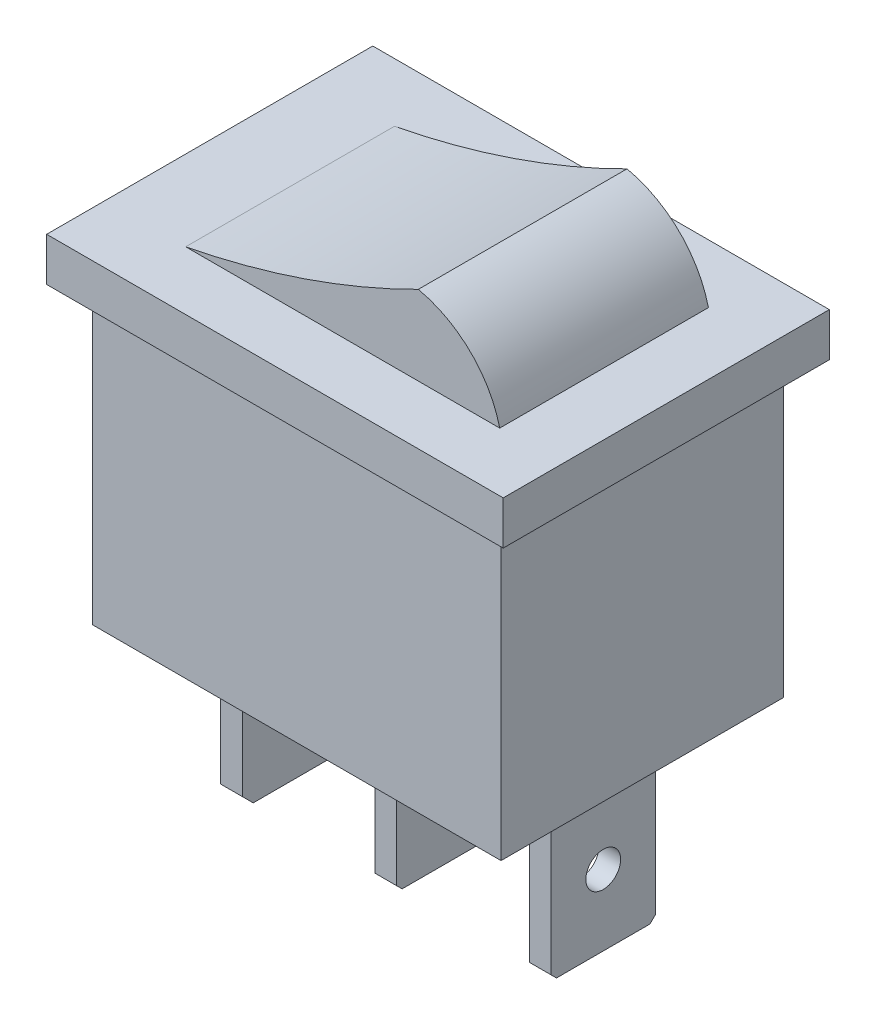
from build123d import *

# Parameters (mm, degrees)
BOSS_EXTRUDE1_DEPTH            = 9.6
SKETCH2_W                      = 21
SKETCH2_H                      = 15
BOSS_EXTRUDE2_DEPTH            = 2
SKETCH3_W                      = 18.8
SKETCH3_H                      = 13
BOSS_EXTRUDE3_DEPTH            = 13.5
SKETCH4_W                      = 1
SKETCH4_H                      = 4.8
BOSS_EXTRUDE4_DEPTH            = 8
SKETCH5_W                      = 1
SKETCH5_H                      = 4.8
BOSS_EXTRUDE5_DEPTH            = 8
SKETCH6_W                      = 1
SKETCH6_H                      = 4.8
BOSS_EXTRUDE6_DEPTH            = 8
F_1_6_1_6_DIAMETER_HOLE1_D     = 1.6
F_1_6_1_6_DIAMETER_HOLE1_DEPTH = 1
F_1_6_1_6_DIAMETER_HOLE2_D     = 1.6
F_1_6_1_6_DIAMETER_HOLE2_DEPTH = 1
F_1_6_1_6_DIAMETER_HOLE3_D     = 1.6
F_1_6_1_6_DIAMETER_HOLE3_DEPTH = 11
CHAMFER1_SIZE                  = 0.25
CHAMFER2_SIZE                  = 0.5


with BuildPart() as part:
    # Sketch1 → Boss-Extrude1 (new body)
    with BuildSketch(Plane(origin=(0, 0, -4.8), x_dir=(-1, 0, 0), z_dir=(0, 0, -1))):
        with BuildLine():
            Line((-7.639445546, 15.5), (6.803913489, 15.5))
            ThreePointArc((6.803913489, 15.5), (1.329165769, 16.958613053), (-3.894073755, 19.15364916))
            ThreePointArc((-3.894073755, 19.15364916), (-6.290531384, 17.863745283), (-7.639445546, 15.5))
        make_face()
    extrude(amount=-BOSS_EXTRUDE1_DEPTH)

    # Sketch2 → Boss-Extrude2 (add)
    with BuildSketch(Plane(origin=(0, 15.5, 0), x_dir=(1, 0, 0), z_dir=(0, 1, 0))):
        Rectangle(SKETCH2_W, SKETCH2_H)
    extrude(amount=-BOSS_EXTRUDE2_DEPTH)

    # Sketch3 → Boss-Extrude3 (add)
    with BuildSketch(Plane.XZ.offset(-13.5)):
        Rectangle(SKETCH3_W, SKETCH3_H)
    extrude(amount=BOSS_EXTRUDE3_DEPTH)

    # Sketch4 → Boss-Extrude4 (add)
    with BuildSketch(Plane.XZ):
        Rectangle(SKETCH4_W, SKETCH4_H)
    extrude(amount=BOSS_EXTRUDE4_DEPTH)

    # Sketch5 → Boss-Extrude5 (add)
    with BuildSketch(Plane.XZ):
        with Locations((7.1, 0)):
            Rectangle(SKETCH5_W, SKETCH5_H)
    extrude(amount=BOSS_EXTRUDE5_DEPTH)

    # Sketch6 → Boss-Extrude6 (add)
    with BuildSketch(Plane.XZ):
        with Locations((-7.1, 0)):
            Rectangle(SKETCH6_W, SKETCH6_H)
    extrude(amount=BOSS_EXTRUDE6_DEPTH)

    # Ø1.6 (1.6) Diameter Hole1
    with Locations(Plane.ZY.offset(7.6)):
        with Locations((0, -4.5)):
            Hole(F_1_6_1_6_DIAMETER_HOLE1_D / 2, depth=F_1_6_1_6_DIAMETER_HOLE1_DEPTH)

    # Ø1.6 (1.6) Diameter Hole2
    with Locations(Plane(origin=(7.6, 0, 0), x_dir=(0, 0, -1), z_dir=(1, 0, 0))):
        with Locations((0, -4.5)):
            Hole(F_1_6_1_6_DIAMETER_HOLE2_D / 2, depth=F_1_6_1_6_DIAMETER_HOLE2_DEPTH)

    # Ø1.6 (1.6) Diameter Hole3
    with Locations(Plane.ZY.offset(0.5)):
        with Locations((0, -4.5)):
            Hole(F_1_6_1_6_DIAMETER_HOLE3_D / 2, depth=F_1_6_1_6_DIAMETER_HOLE3_DEPTH)

    # Chamfer1
    chamfer1_edges = [part.edges().sort_by_distance(p)[0] for p in [
        (-0.5, -8, 0),
        (0.5, -8, 0),
        (6.6, -8, 0),
        (7.6, -8, 0),
    ]]
    chamfer(chamfer1_edges, length=CHAMFER1_SIZE)

    # Chamfer2
    chamfer2_edges = [part.edges().sort_by_distance(p)[0] for p in [
        (7.1, -8, 2.4),
        (-7.1, -8, -2.4),
        (7.1, -8, -2.4),
        (0, -8, -2.4),
        (-7.1, -8, 2.4),
        (0, -8, 2.4),
    ]]
    chamfer(chamfer2_edges, length=CHAMFER2_SIZE)


solid = part.part
